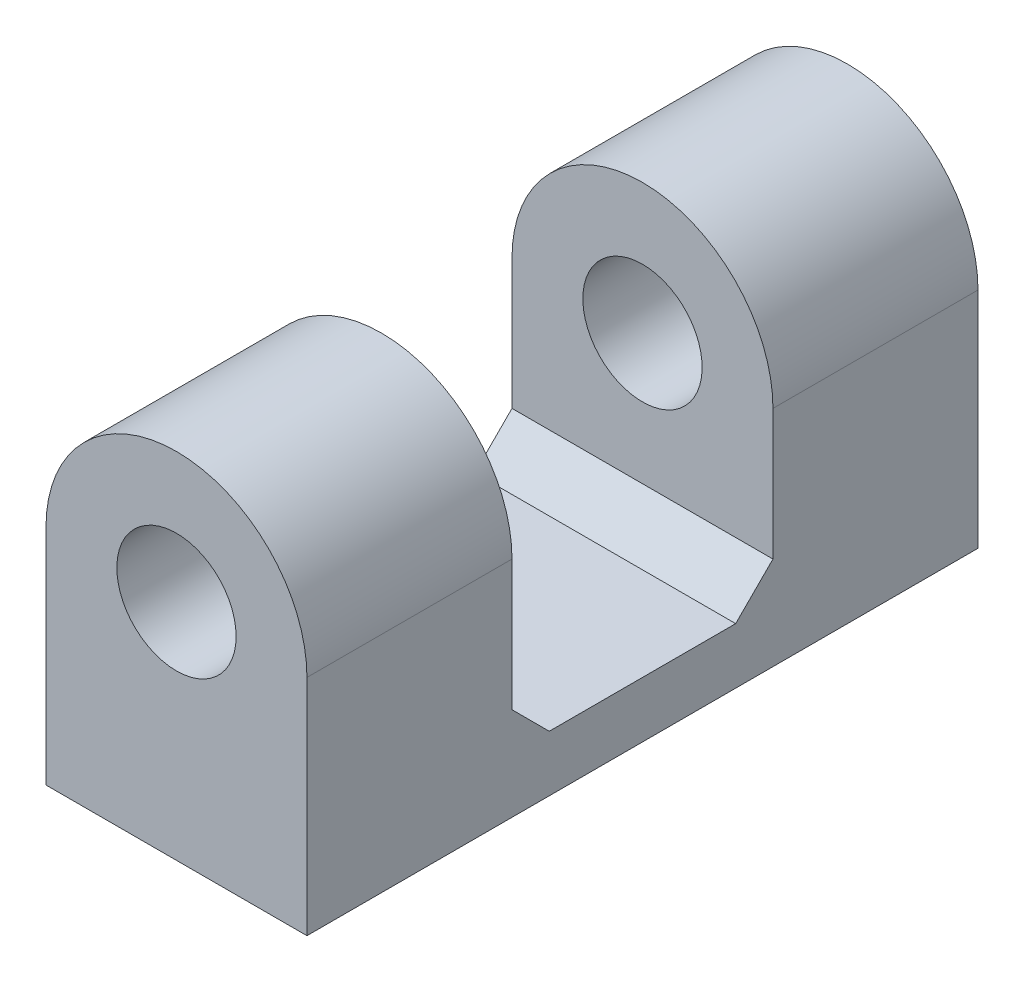
from build123d import *

# Parameters (mm, degrees)
SKETCH_1_R             = 1.6
EXTRUDE_1_DEPTH        = 18
SKETCH_3_W             = 7
SKETCH_3_H             = 11.399287815
CUT_EXTRUDE_2_DEPTH    = 21.223748416
HOLE_WIZARD_M3_1_D     = 2.5
HOLE_WIZARD_M3_1_DEPTH = 3.5
HOLE_WIZARD_M3_1_TIP   = 0.751075774
CHAMFER_1_SIZE         = 1


with BuildPart() as part:
    # 草图1 → 凸台-拉伸1 (new body)
    with BuildSketch(Plane.XY):
        with BuildLine():
            Line((-3.5, -6), (-3.5, 0))
            ThreePointArc((-3.5, 0), (0, 3.5), (3.5, 0))
            Line((3.5, 0), (3.5, -6))
            Line((3.5, -6), (-3.5, -6))
        make_face()
        Circle(SKETCH_1_R, mode=Mode.SUBTRACT)
    extrude(amount=EXTRUDE_1_DEPTH)

    # 草图3 → 切除-拉伸2 (cut, through all)
    with BuildSketch(Plane.ZY.offset(3.5)):
        with Locations((9, 1.199643908)):
            Rectangle(SKETCH_3_W, SKETCH_3_H)
    extrude(amount=-CUT_EXTRUDE_2_DEPTH, mode=Mode.SUBTRACT)

    # M3 螺纹孔1
    with Locations(Plane(origin=(0, -6, 0), x_dir=(-1, 0, 0), z_dir=(0, -1, 0))):
        with Locations((0, -3), (0, -15)):
            Hole(HOLE_WIZARD_M3_1_D / 2, depth=HOLE_WIZARD_M3_1_DEPTH)
            with Locations((0, 0, -(HOLE_WIZARD_M3_1_DEPTH + HOLE_WIZARD_M3_1_TIP / 2))):  # 118° drill point
                Cone(0, HOLE_WIZARD_M3_1_D / 2, HOLE_WIZARD_M3_1_TIP, mode=Mode.SUBTRACT)

    # 倒角1
    chamfer_1_edges = [part.edges().sort_by_distance(p)[0] for p in [
        (0, -4.5, 5.5),
        (0, -4.5, 12.5),
    ]]
    chamfer(chamfer_1_edges, length=CHAMFER_1_SIZE)


solid = part.part
